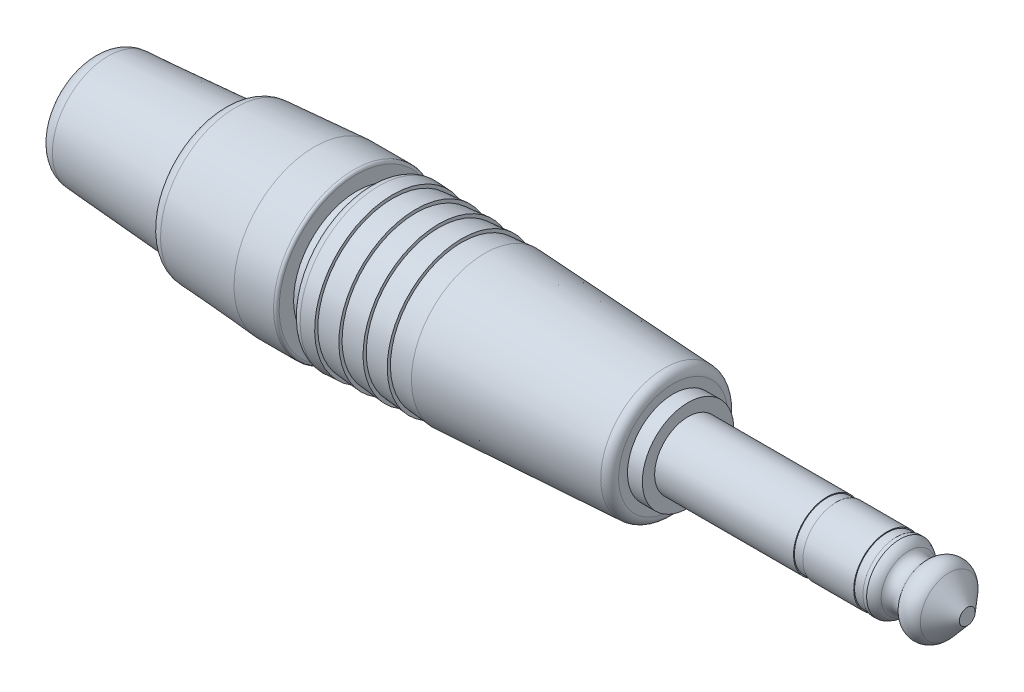
from build123d import *

# Parameters (mm, degrees)
SCALE1_SCALE = 0.5


with BuildPart() as part:
    # Sketch1 → Revolve1 (revolve)
    with BuildSketch(Plane.XY):
        with BuildLine():
            Line((0, 3.61779925), (15.032406451, 3.61779925))
            Line((15.032406451, 3.61779925), (15.032406667, 3.522593793))
            Line((15.032406667, 3.522593793), (16.03456712, 3.522593793))
            Line((16.03456712, 3.522593793), (16.03456712, 3.61779925))
            Line((16.03456712, 3.61779925), (21.546449611, 3.61779925))
            Line((21.546449611, 3.61779925), (21.546449611, 3.522593793))
            Line((21.546449611, 3.522593793), (22.548610065, 3.522593793))
            Line((22.548610065, 3.522593793), (22.548610065, 3.61779925))
            Line((22.548610065, 3.61779925), (22.944871766, 3.61779925))
            ThreePointArc((22.944871766, 3.61779925), (23.465785592, 3.377136862), (23.867528684, 2.9674149))
            ThreePointArc((23.867528684, 2.9674149), (24.803470756, 2.470325447), (25.739412926, 2.967414715))
            ThreePointArc((25.739412926, 2.967414715), (26.962108712, 3.664996602), (28.260046896, 3.120054456))
            Line((28.260046896, 3.120054456), (30.225555542, 0.857736821))
            Line((30.225555542, 0.857736821), (30.225555542, 0))
            Line((30.225555542, 0), (-64.609555363, 0))
            Line((-64.609555363, 0), (-64.609555363, 4.065084821))
            ThreePointArc((-64.609555363, 4.065084821), (-64.074690646, 5.422917), (-62.757476554, 6.051196814))
            Line((-62.757476554, 6.051196814), (-50.373401069, 6.917175432))
            ThreePointArc((-50.373401069, 6.917175432), (-49.879647769, 7.743143412), (-48.989810035, 8.109482088))
            Line((-48.989810035, 8.109482088), (-40.438405382, 8.707454885))
            Line((-40.438405382, 8.707454885), (-36.165060835, 8.707454885))
            ThreePointArc((-36.165060835, 8.707454885), (-35.949224247, 8.618052326), (-35.859822048, 8.402215589))
            Line((-35.859822048, 8.402215589), (-35.859822048, 6.837081154))
            Line((-35.859822048, 6.837081154), (-34.45713168, 6.837081154))
            Line((-34.45713168, 6.837081154), (-34.45713168, 7.533917861))
            ThreePointArc((-34.45713168, 7.533917861), (-34.165562064, 8.237829182), (-33.461650742, 8.529398798))
            Line((-33.461650742, 8.529398798), (-31.96842959, 8.451065892))
            Line((-31.96842959, 8.451065892), (-31.96842959, 8.10277763))
            Line((-31.96842959, 8.10277763), (-29.47972801, 8.320510958))
            Line((-29.47972801, 8.320510958), (-29.47972801, 7.972223112))
            Line((-29.47972801, 7.972223112), (-26.99102592, 8.189955931))
            Line((-26.99102592, 8.189955931), (-26.99102592, 7.841668085))
            Line((-26.99102592, 7.841668085), (-24.50232383, 8.059401413))
            Line((-24.50232383, 8.059401413), (-24.50232383, 7.711113058))
            Line((-24.50232383, 7.711113058), (-22.01362225, 7.928846386))
            Line((-22.01362225, 7.928846386), (-2.5495968, 6.907782984))
            ThreePointArc((-2.5495968, 6.907782984), (-1.879633367, 6.59889477), (-1.606266336, 5.913669701))
            Line((-1.606266336, 5.913669701), (-1.606266336, 4.95067259))
            Line((-1.606266336, 4.95067259), (0, 4.95067259))
            Line((0, 4.95067259), (0, 3.61779925))
        make_face()
    revolve(axis=Axis((30.225555542, 0, 0), (1, 0, 0)))


with BuildPart() as part_1:
    # Scale1: scaled about (-27.821598446, 0, 0)
    add(part.part.scale(SCALE1_SCALE).moved(Location((-13.910799223, 0, 0))))


solid = part_1.part
